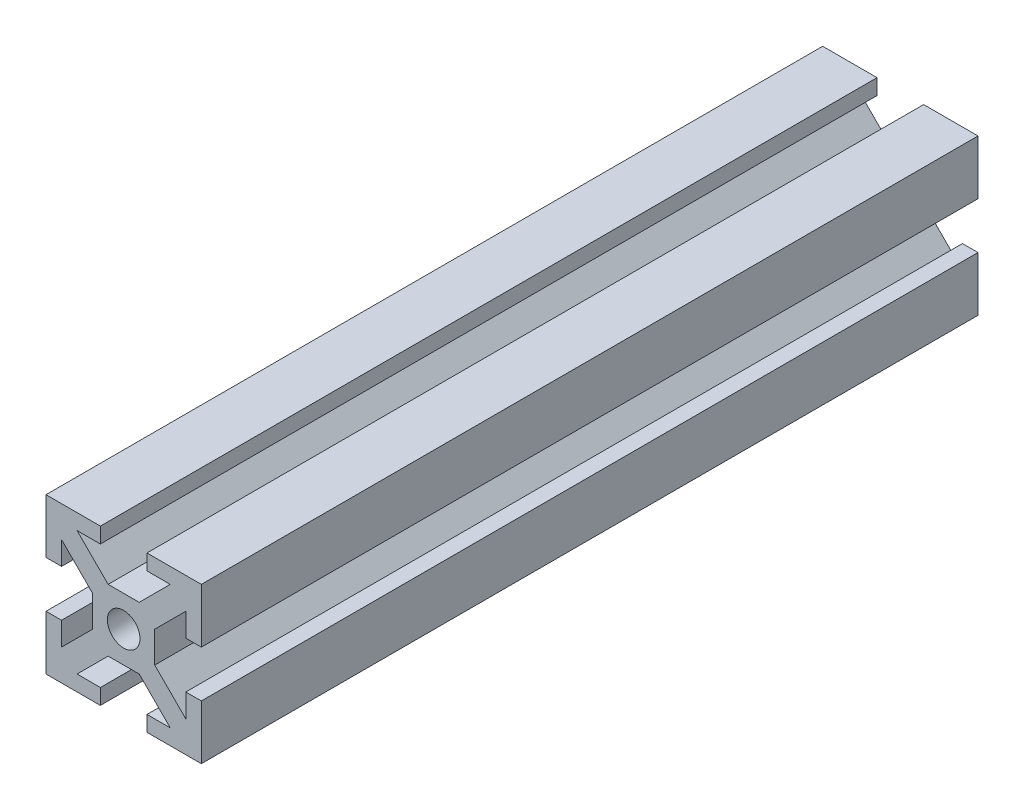
from build123d import *

# Parameters (mm, degrees)
SKETCH1_W           = 8
SKETCH1_H           = 8
SKETCH1_R           = 2.1
BOSS_EXTRUDE1_DEPTH = 100


with BuildPart() as part:
    # Sketch1 → Boss-Extrude1 (new body)
    # profile 1 of 5: a face of its own
    with BuildSketch(Plane.XY):
        Polygon((2, 16), (6, 12), (6, 14), (8, 14), (4, 18), (7, 18), (7, 20), (0, 20), (0, 13), (2, 13), align=None)
    # profile 2 of 5: a face of its own
    with BuildSketch(Plane.XY):
        Polygon((16, 18), (12, 14), (14, 14), (14, 12), (18, 16), (18, 13), (20, 13), (20, 20), (13, 20), (13, 18), align=None)
    # profile 3 of 5: a face of its own
    with BuildSketch(Plane.XY):
        with Locations((10, 10)):
            Rectangle(SKETCH1_W, SKETCH1_H)
        with Locations((10, 10)):
            Circle(SKETCH1_R, mode=Mode.SUBTRACT)
    # profile 4 of 5: a face of its own
    with BuildSketch(Plane.XY):
        Polygon((6, 8), (2, 4), (2, 7), (0, 7), (0, 0), (7, 0), (7, 2), (4, 2), (8, 6), (6, 6), align=None)
    # profile 5 of 5: a face of its own
    with BuildSketch(Plane.XY):
        Polygon((14, 6), (12, 6), (16, 2), (13, 2), (13, 0), (20, 0), (20, 7), (18, 7), (18, 4), (14, 8), align=None)
    extrude(amount=BOSS_EXTRUDE1_DEPTH)


solid = part.part
